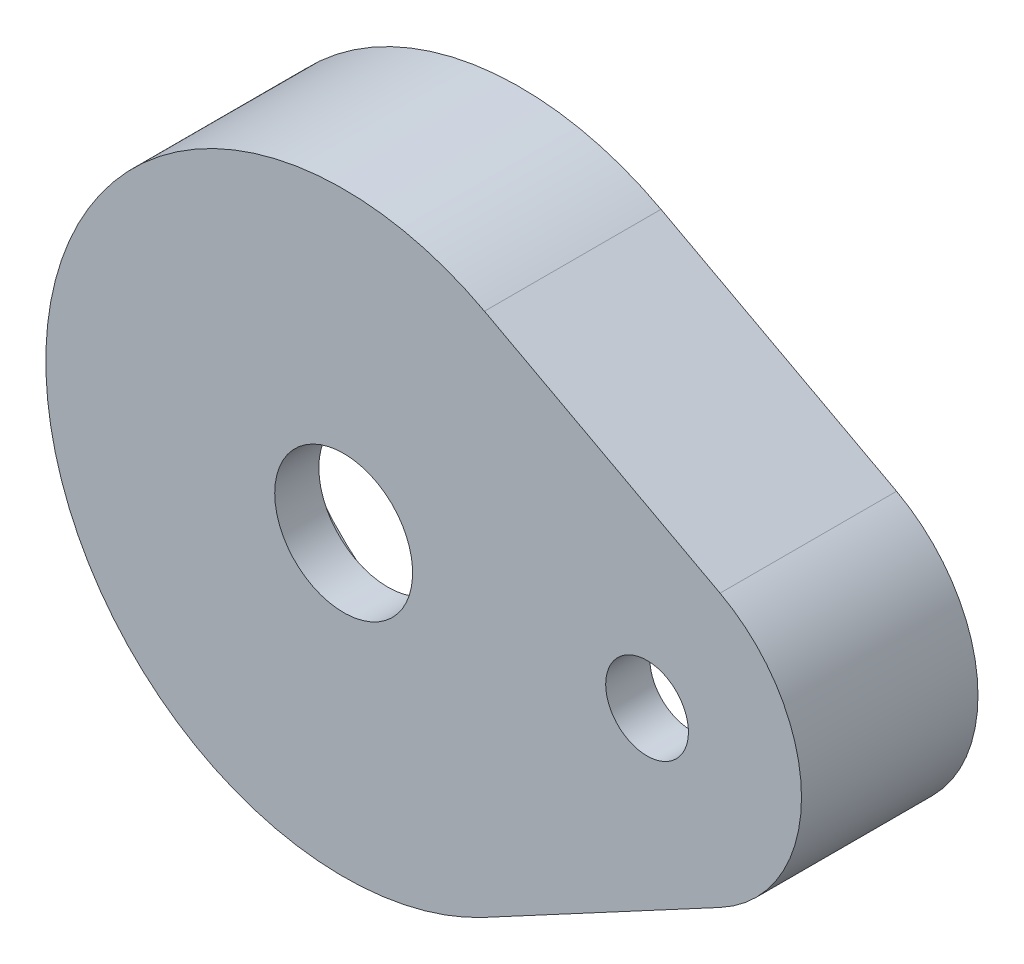
from build123d import *

# Parameters (mm, degrees)
BOSS_EXTRUDE1_DEPTH     = 10.16
CUT_EXTRUDE1_DEPTH      = 7.62
CUT_EXTRUDE2_DEPTH      = 33.349183626
CUT_EXTRUDE2_DEPTH_BACK = 33.349183626
SKETCH3_R               = 3.96875
SKETCH3_R_2             = 2.38125


with BuildPart() as part:
    # Sketch1 → Boss-Extrude1 (new body)
    with BuildSketch(Plane.XY):
        with BuildLine():
            Line((8.104909091, 15.108324647), (21.665045455, 7.833946113))
            ThreePointArc((21.665045455, 7.833946113), (26.3525, 0), (21.665045455, -7.833946113))
            Line((21.665045455, -7.833946113), (8.104909091, -15.108324647))
            ThreePointArc((8.104909091, -15.108324647), (-17.145, 0), (8.104909091, 15.108324647))
        make_face()
    extrude(amount=BOSS_EXTRUDE1_DEPTH)

    # Sketch2 → Cut-Extrude1 (cut)
    with BuildSketch(Plane.XY):
        with BuildLine():
            Line((6.904181818, 12.870054329), (20.464318182, 5.595675795))
            ThreePointArc((20.464318182, 5.595675795), (23.8125, 0), (20.464318182, -5.595675795))
            Line((20.464318182, -5.595675795), (6.904181818, -12.870054329))
            ThreePointArc((6.904181818, -12.870054329), (-14.605, 0), (6.904181818, 12.870054329))
        make_face()
    extrude(amount=CUT_EXTRUDE1_DEPTH, mode=Mode.SUBTRACT)

    # Sketch3 → Cut-Extrude2 (cut, two sides: drawn at the far end of the back side and taken through both)
    with BuildSketch(Plane(origin=(0, 0, 7.62), x_dir=(-1, 0, 0), z_dir=(0, 0, -1)).offset(-CUT_EXTRUDE2_DEPTH_BACK)):
        Circle(SKETCH3_R)
        with Locations((-17.4625, 0)):
            Circle(SKETCH3_R_2)
    extrude(amount=CUT_EXTRUDE2_DEPTH + CUT_EXTRUDE2_DEPTH_BACK, mode=Mode.SUBTRACT)


solid = part.part
